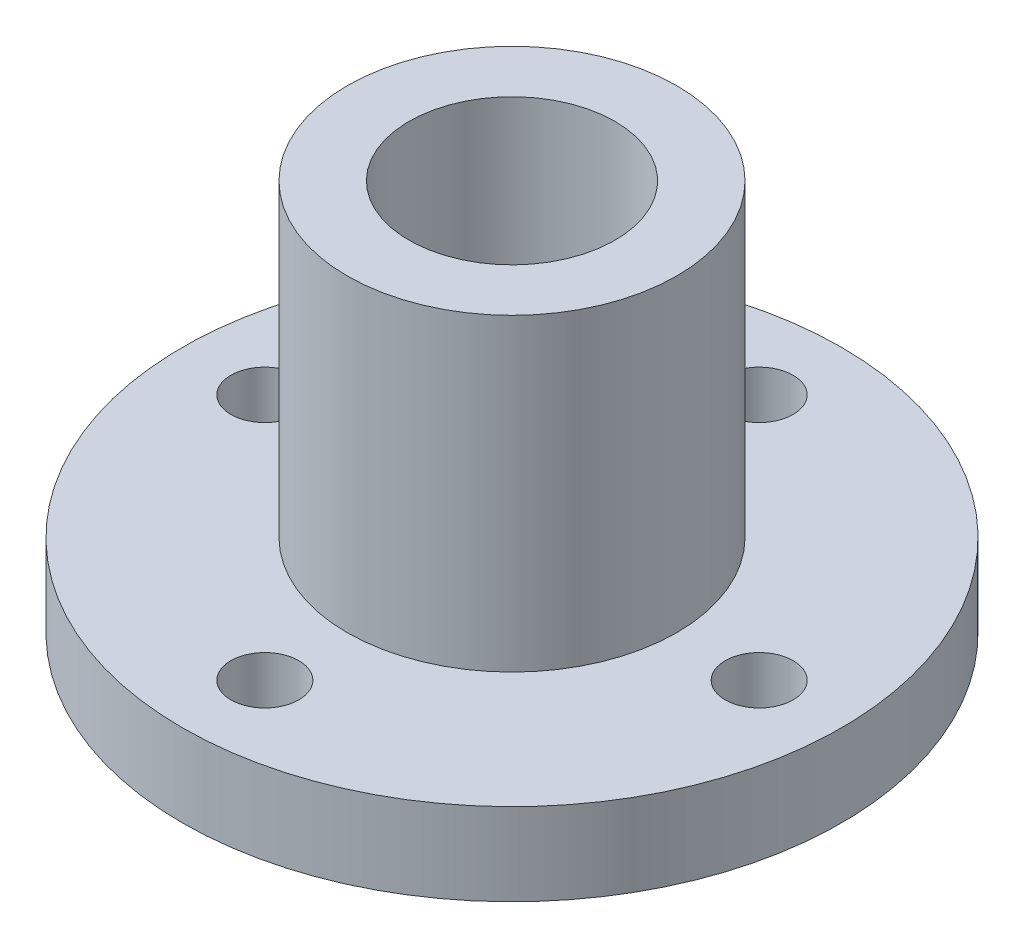
from build123d import *

# Parameters (mm, degrees)
F_3_3_3_3_DIAMETER_HOLE1_D = 3.3


with BuildPart() as part:
    # Sketch1 → Revolve1 (revolve)
    with BuildSketch(Plane.XY, mode=Mode.PRIVATE) as revolve1_sk:
        Polygon((-5, 0), (-5, 19), (-8, 19), (-8, 4), (-16, 4), (-16, 0), align=None)
    revolve(revolve1_sk.sketch.rotate(Axis((0, 0, 0), (0, 1, 0)), 270), axis=Axis((0, 0, 0), (0, 1, 0)))

    # Ø3.3 (3.3) Diameter Hole1 (through all)
    with Locations(Plane(origin=(0, 0, 0), x_dir=(-1, 0, 0), z_dir=(0, -1, 0))):
        with Locations((-12, 0), (0, 12), (12, 0), (0, -12)):
            Hole(F_3_3_3_3_DIAMETER_HOLE1_D / 2)


solid = part.part
